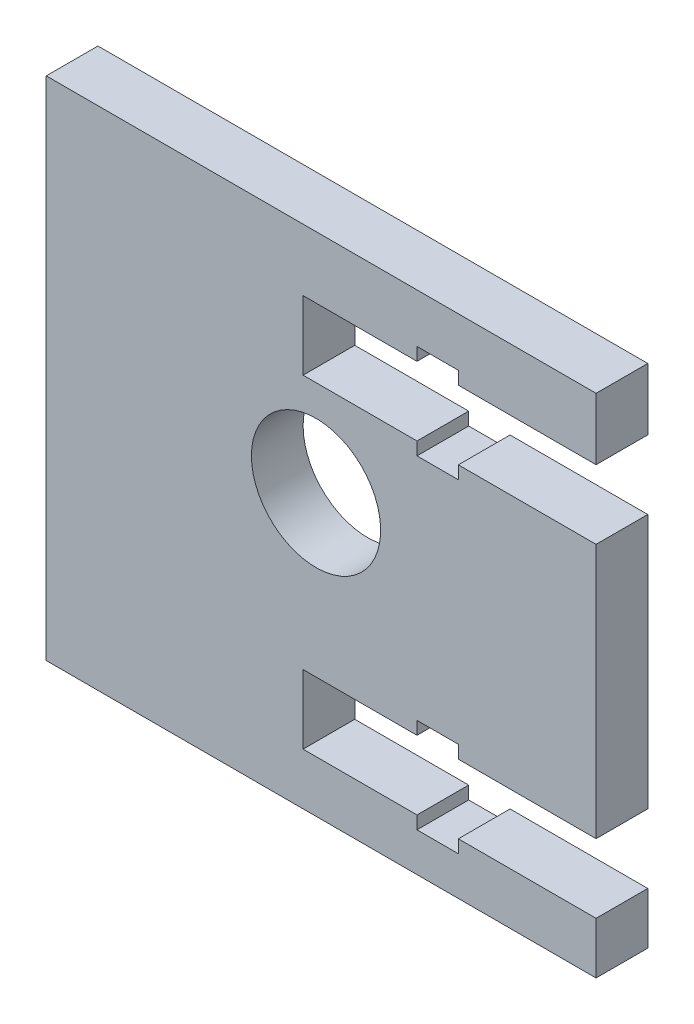
from build123d import *

# Parameters (mm, degrees)
SKETCH1_W           = 31.901767955
SKETCH1_H           = 28.791004307
BOSS_EXTRUDE2_DEPTH = 3
SKETCH3_R           = 3.75
CUT_EXTRUDE1_DEPTH  = 33
CUT_EXTRUDE2_DEPTH  = 33
SKETCH6_W           = 31.901767955
SKETCH6_H           = 0.59
BOSS_EXTRUDE3_DEPTH = 3


with BuildPart() as part:
    # Sketch1 → Boss-Extrude2 (new body)
    with BuildSketch(Plane.XY):
        with Locations((13.594756215, 69.164541294)):
            Rectangle(SKETCH1_W, SKETCH1_H)
    extrude(amount=BOSS_EXTRUDE2_DEPTH)

    # Sketch3 → Cut-Extrude1 (cut)
    with BuildSketch(Plane(origin=(0, 0, 0), x_dir=(-1, 0, 0), z_dir=(0, 0, -1))):
        with Locations((-13.297916625, 71.016762707)):
            Circle(SKETCH3_R)
    extrude(amount=-CUT_EXTRUDE1_DEPTH, mode=Mode.SUBTRACT)

    # Sketch5 → Cut-Extrude2 (cut)
    with BuildSketch(Plane.XY.offset(3)):
        Polygon((29.545640192, 76.560043447), (21.555740858, 76.560043447), (21.555740858, 75.810043447), (19.155740858, 75.810043447), (19.155740858, 76.560043447), (12.545640192, 76.560043447), (12.545640192, 80.560043447), (19.155740858, 80.560043447), (19.155740858, 81.310043447), (21.555740858, 81.310043447), (21.555740858, 80.560043447), (29.545640192, 80.560043447), align=None)
        Polygon((29.545640192, 57.76903914), (29.545640192, 61.76903914), (21.555740858, 61.76903914), (21.555740858, 62.51903914), (19.155740858, 62.51903914), (19.155740858, 61.76903914), (12.545640192, 61.76903914), (12.545640192, 57.76903914), (19.155740858, 57.76903914), (19.155740858, 57.01903914), (21.555740858, 57.01903914), (21.555740858, 57.76903914), align=None)
    extrude(amount=-CUT_EXTRUDE2_DEPTH, mode=Mode.SUBTRACT)

    # Sketch6 → Boss-Extrude3 (add)
    with BuildSketch(Plane.XY.offset(3)):
        with Locations((13.594756215, 83.855043447)):
            Rectangle(SKETCH6_W, SKETCH6_H)
    extrude(amount=-BOSS_EXTRUDE3_DEPTH)


solid = part.part
